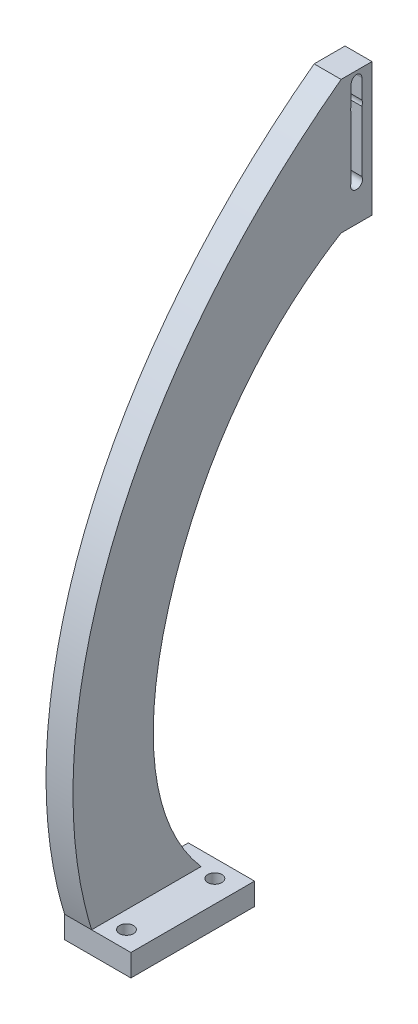
from build123d import *

# Parameters (mm, degrees)
SKETCH_1_W           = 20
SKETCH_1_H           = 28
SKETCH_1_R           = 1.6
EXTRUDE_1_DEPTH      = 5
EXTRUDE_2_DEPTH      = 5
EXTRUDE_2_DEPTH_BACK = 1.1
SKETCH_3_W           = 6.1
SKETCH_3_H           = 30.125226912
EXTRUDE_3_DEPTH      = 7
SKETCH_4_R           = 1.35
CUT_EXTRUDE_1_DEPTH  = 7
SKETCH_5_W           = 5
SKETCH_5_H           = 28
CUT_EXTRUDE_2_DEPTH  = 10
CUT_EXTRUDE_3_DEPTH  = 10


with BuildPart() as part:
    # 草图1 → 凸台-拉伸1 (new body)
    with BuildSketch(Plane(origin=(0, 0, 0), x_dir=(1, 0, 0), z_dir=(0, 1, 0))):
        Rectangle(SKETCH_1_W, SKETCH_1_H)
        with Locations(Location((-5, 10, 0), (0, 0, 270))):
            Circle(SKETCH_1_R, mode=Mode.SUBTRACT)
        with Locations(Location((5, 10, 0), (0, 0, 90))):
            Circle(SKETCH_1_R, mode=Mode.SUBTRACT)
        with Locations(Location((5, -10, 0), (0, 0, 270))):
            Circle(SKETCH_1_R, mode=Mode.SUBTRACT)
        with Locations(Location((-5, -10, 0), (0, 0, 90))):
            Circle(SKETCH_1_R, mode=Mode.SUBTRACT)
    extrude(amount=EXTRUDE_1_DEPTH)

    # 草图2 → 凸台-拉伸2 (add, two sides: drawn at the far end of the back side and taken through both)
    with BuildSketch(Plane(origin=(0, 0, 0), x_dir=(0, 0, -1), z_dir=(1, 0, 0)).offset(-EXTRUDE_2_DEPTH_BACK)):
        with BuildLine():
            Line((42.482395746, 143.5), (42.482395746, 113.374773088))
            add(Edge.make_bspline(
                [(10.794309538, 5), (-3.625508376, 21.700163207), (-0.038874902, 68.530494039), (24.786643579, 102.563540472), (42.482395746, 113.374773088)],
                knots=[0, 0, 0, 0, 0.510479212, 1, 1, 1, 1], degree=3))
            Line((10.794309538, 5), (-14, 5))
            add(Edge.make_bspline(
                [(-14, 5), (-21.090980053, 28.072383436), (-16.059602837, 83.599622922), (19.318940175, 126.307389699), (42.482395746, 143.5)],
                knots=[0, 0, 0, 0, 0.452386754, 1, 1, 1, 1], degree=3))
        make_face()
    extrude(amount=EXTRUDE_2_DEPTH + EXTRUDE_2_DEPTH_BACK)

    # 草图3 → 凸台-拉伸3 (add)
    with BuildSketch(Plane(origin=(0, 0, -42.482395746), x_dir=(-1, 0, 0), z_dir=(0, 0, -1))):
        with Locations((-1.95, 128.437386544)):
            Rectangle(SKETCH_3_W, SKETCH_3_H)
    extrude(amount=EXTRUDE_3_DEPTH)

    # 草图4 → 切除-拉伸1 (cut)
    with BuildSketch(Plane(origin=(5, 0, 0), x_dir=(0, 0, -1), z_dir=(1, 0, 0))):
        with Locations((45.982395746, 136.5)):
            Circle(SKETCH_4_R)
        with Locations((45.982395746, 121.5)):
            Circle(SKETCH_4_R)
    extrude(amount=-CUT_EXTRUDE_1_DEPTH, mode=Mode.SUBTRACT)


with BuildPart() as body_2:
    # 镜向1: mirrored copy
    add(part.part.mirror(Plane(origin=(20, 0, 0), x_dir=(0, 0, 1), z_dir=(1, 0, 0))))

    # 草图5 → 切除-拉伸2 (cut)
    with BuildSketch(Plane(origin=(0, 5, 0), x_dir=(1, 0, 0), z_dir=(0, 1, 0))):
        with Locations((32.5, 0)):
            Rectangle(SKETCH_5_W, SKETCH_5_H)
    extrude(amount=-CUT_EXTRUDE_2_DEPTH, mode=Mode.SUBTRACT)

    # 草图6 → 切除-拉伸3 (cut)
    with BuildSketch(Plane(origin=(41.1, 0, 0), x_dir=(0, 0, -1), z_dir=(1, 0, 0))):
        with BuildLine():
            Line((47.182395746, 141.5), (47.182395746, 121.5))
            ThreePointArc((47.182395746, 121.5), (45.982395746, 120.3), (44.782395746, 121.5))
            Line((44.782395746, 121.5), (44.782395746, 141.5))
            ThreePointArc((44.782395746, 141.5), (45.982395746, 142.7), (47.182395746, 141.5))
        make_face()
    extrude(amount=-CUT_EXTRUDE_3_DEPTH, mode=Mode.SUBTRACT)


solid = body_2.part
